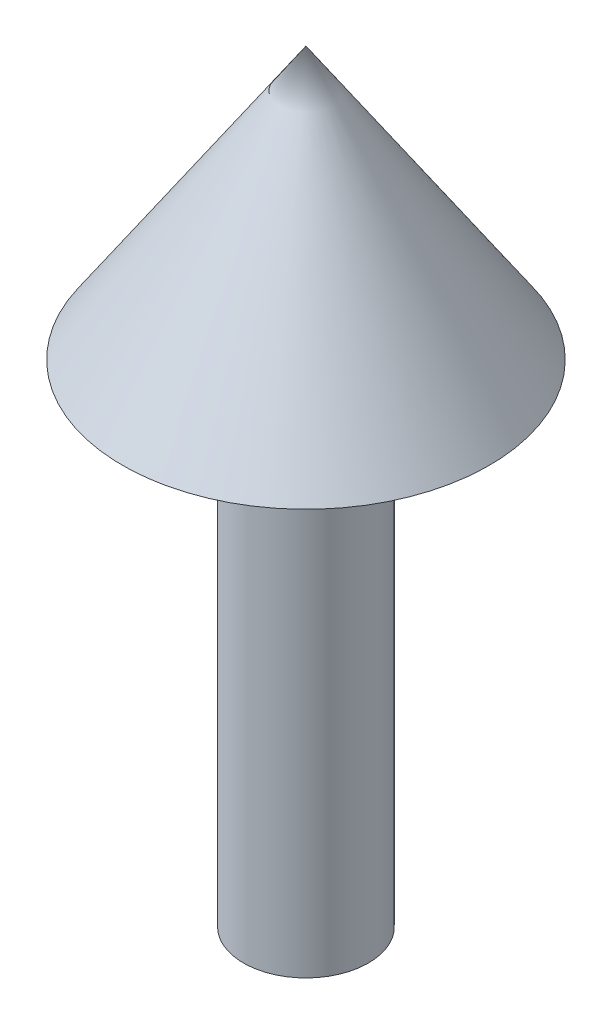
from build123d import *

# Parameters (mm, degrees)
SKETCH4_W = 4
SKETCH4_H = 31.437558866


with BuildPart() as part:
    # Sketch4 → Revolve1 (revolve)
    with BuildSketch(Plane.XY, mode=Mode.PRIVATE) as revolve1_sk:
        Polygon((0, 48.812829131), (0, 31.437558866), (4, 31.437558866), (11.731038953, 31.437558866), align=None)
        with Locations((2, 15.718779433)):
            Rectangle(SKETCH4_W, SKETCH4_H)
    revolve(revolve1_sk.sketch.rotate(Axis((0, 31.437558866, 0), (0, 1, 0)), 90), axis=Axis((0, 31.437558866, 0), (0, 1, 0)))


solid = part.part
